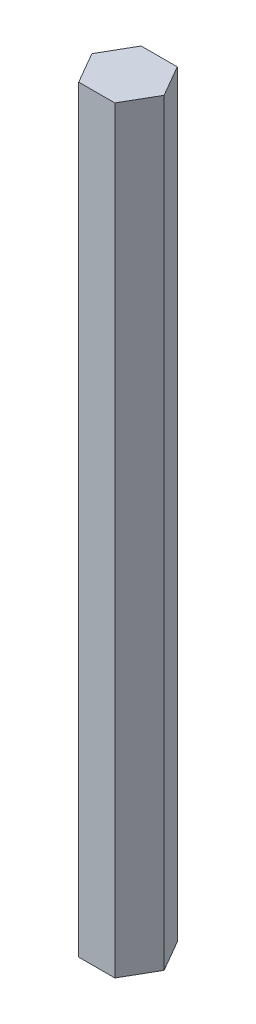
from build123d import *

# Parameters (mm, degrees)
BOSS_EXTRUDE1_DEPTH = 63
SKETCH3_R           = 1.6
CUT_EXTRUDE1_DEPTH  = 5


with BuildPart() as part:
    # Sketch1 → Boss-Extrude1 (new body)
    with BuildSketch(Plane(origin=(0, 0, 0), x_dir=(1, 0, 0), z_dir=(0, 1, 0))):
        Polygon((3, 0), (1.5, 2.598076211), (-1.5, 2.598076211), (-3, 0), (-1.5, -2.598076211), (1.5, -2.598076211), align=None)
    extrude(amount=BOSS_EXTRUDE1_DEPTH)

    # Sketch3 → Cut-Extrude1 (cut)
    with BuildSketch(Plane.XZ):
        with Locations(Location((0, 0, 0), (0, 0, 270))):
            Circle(SKETCH3_R)
    extrude(amount=-CUT_EXTRUDE1_DEPTH, mode=Mode.SUBTRACT)


solid = part.part
